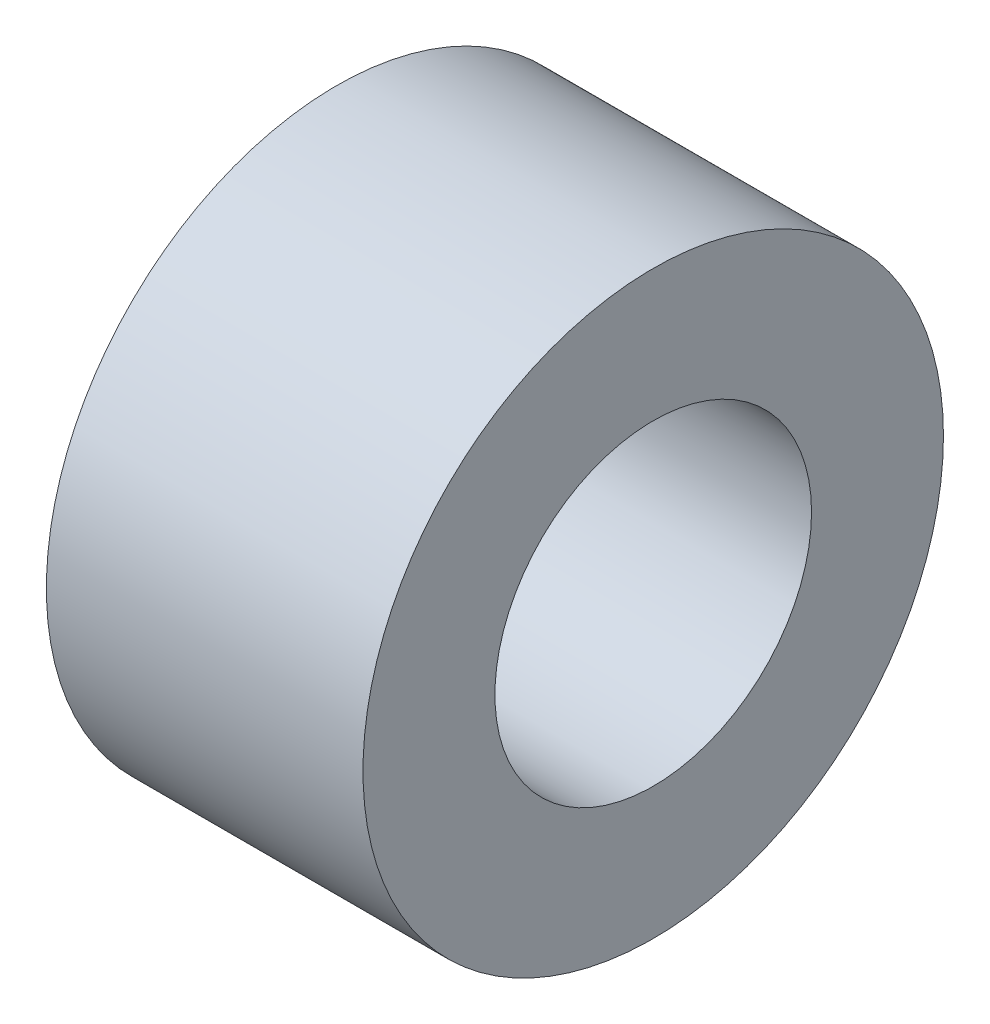
from build123d import *

# Parameters (mm, degrees)
SKETCH_1_R      = 5.5
SKETCH_1_R_2    = 3
EXTRUDE_1_DEPTH = 6


with BuildPart() as part:
    # 草图1 → 凸台-拉伸1 (new body)
    with BuildSketch(Plane(origin=(0, 0, 0), x_dir=(0, 0, -1), z_dir=(1, 0, 0))):
        Circle(SKETCH_1_R)
        Circle(SKETCH_1_R_2, mode=Mode.SUBTRACT)
    extrude(amount=EXTRUDE_1_DEPTH)


solid = part.part
